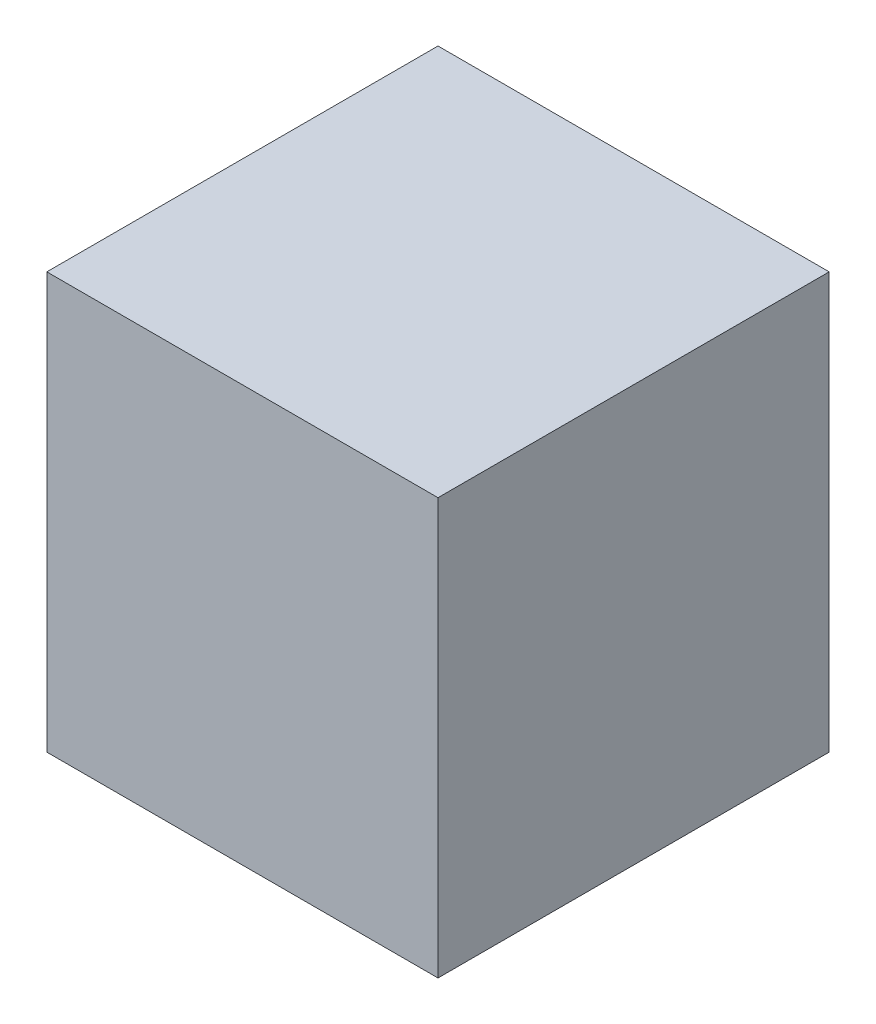
from build123d import *

# Parameters (mm, degrees)
SKETCH1_W      = 56.8
SKETCH1_H      = 60.4
ENVELOPE_DEPTH = 56.8


with BuildPart() as part:
    # Sketch1 → Envelope (new body)
    with BuildSketch(Plane.XY):
        Rectangle(SKETCH1_W, SKETCH1_H)
    extrude(amount=ENVELOPE_DEPTH)


solid = part.part
